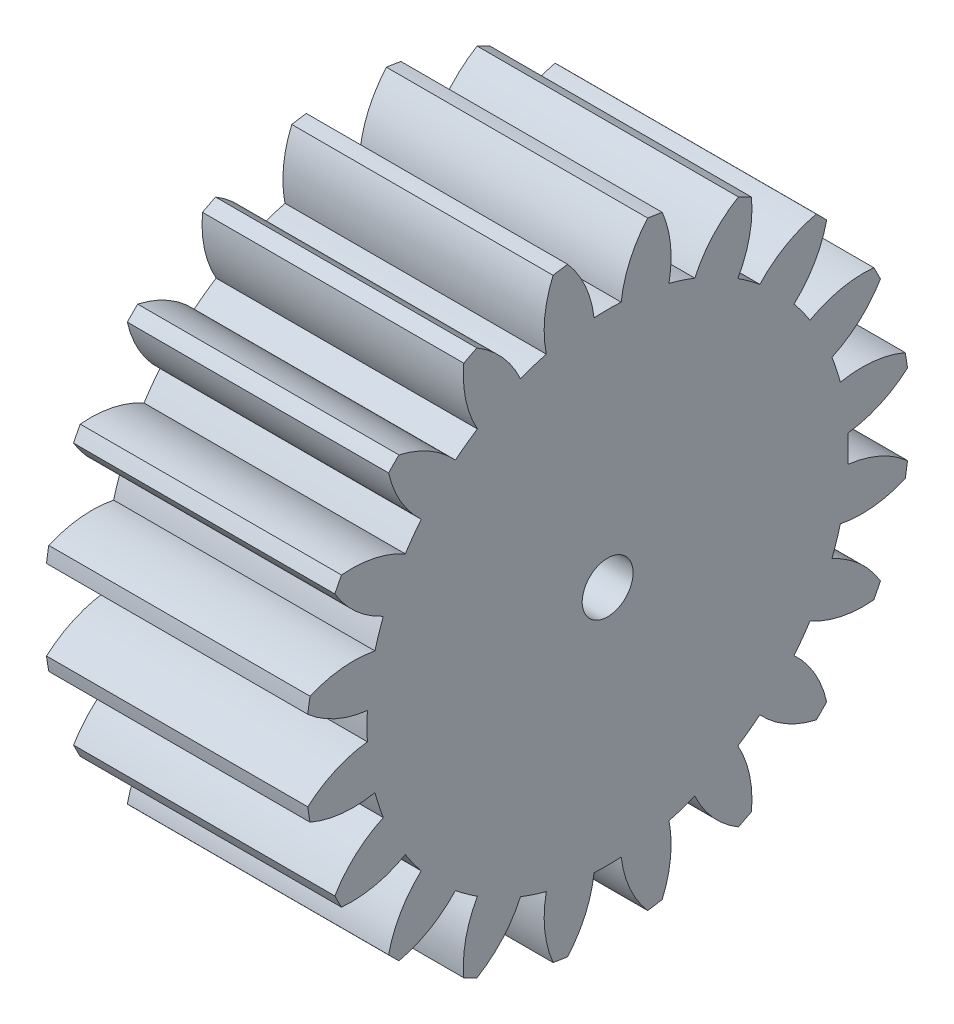
from build123d import *

# Parameters (mm, degrees)
BASPROSKE_W        = 19
BASPROSKE_H        = 22
TOOTHCUT_DEPTH     = 37.455452267
TEETHCUTS_COUNT    = 20
TEETHCUTS_ANGLE    = 342
SKETCH1_R          = 1.85
CUT_EXTRUDE1_DEPTH = 37.221987796


with BuildPart() as part:
    # BasProSke → Base-Revolve (revolve)
    with BuildSketch(Plane(origin=(0, 0, 0), x_dir=(1, 0, 0), z_dir=(0, 1, 0)), mode=Mode.PRIVATE) as base_revolve_sk:
        with Locations((9.5, 11)):
            Rectangle(BASPROSKE_W, BASPROSKE_H)
    revolve(base_revolve_sk.sketch.rotate(Axis((-10, 0, 0), (1, 0, 0)), 180), axis=Axis((-10, 0, 0), (1, 0, 0)))

    # TooCutSke → ToothCut (cut, through all)
    with BuildSketch(Plane(origin=(0, 0, 0), x_dir=(0, 0, -1), z_dir=(1, 0, 0))):
        with BuildLine():
            ThreePointArc((0.986171591, 17.471189616), (0, 17.499), (-0.986171591, 17.471189616))
            ThreePointArc((-0.986171591, 17.471189616), (-1.626916196, 19.798789858), (-2.932850173, 21.829260982))
            ThreePointArc((-2.932850173, 21.829260982), (0, 22.0254), (2.932850173, 21.829260982))
            ThreePointArc((2.932850173, 21.829260982), (1.626916196, 19.798789858), (0.986171591, 17.471189616))
        make_face()
    toothcut = extrude(amount=TOOTHCUT_DEPTH, mode=Mode.SUBTRACT)

    # TeethCuts: ToothCut ×20 about axis
    teethcuts_axis = Axis((-10, 0, 0), (1, 0, 0))
    for i in range(1, TEETHCUTS_COUNT):
        add(toothcut.rotate(teethcuts_axis, i * TEETHCUTS_ANGLE / (TEETHCUTS_COUNT - 1)), mode=Mode.SUBTRACT)

    # Sketch1 → Cut-Extrude1 (cut, through all)
    with BuildSketch(Plane(origin=(19, 0, 0), x_dir=(0, 0, -1), z_dir=(1, 0, 0))):
        Circle(SKETCH1_R)
    extrude(amount=-CUT_EXTRUDE1_DEPTH, mode=Mode.SUBTRACT)


solid = part.part
